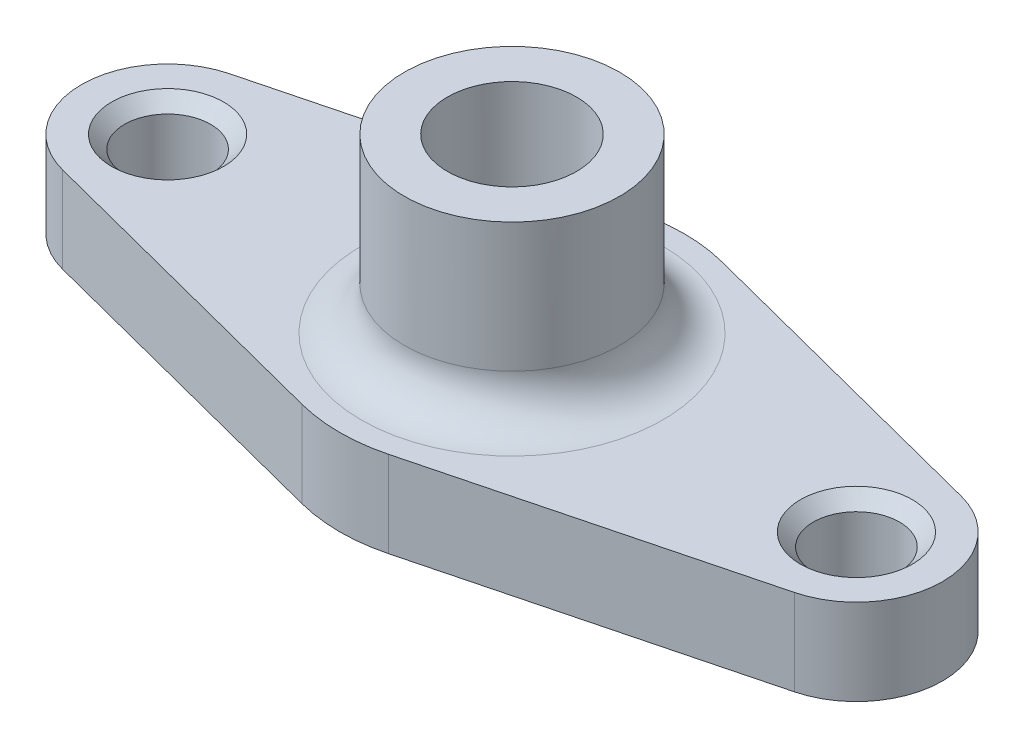
from build123d import *

# Parameters (mm, degrees)
SKETCH5_R            = 10
SKETCH5_R_2          = 40
SKETCH5_R_3          = 25
SKETCH5_R_4          = 15
BOSS_EXTRUDE11_DEPTH = 20
SKETCH11_R           = 25
SKETCH11_R_2         = 15
BOSS_EXTRUDE12_DEPTH = 60
CHAMFER3_SIZE        = 3
FILLET2_R            = 10
CHAMFER4_SIZE        = 3


with BuildPart() as part:
    # Sketch5 → Boss-Extrude11 (new body)
    # profile 1 of 4: a face of its own
    with BuildSketch(Plane(origin=(0, 0, 0), x_dir=(1, 0, 0), z_dir=(0, 1, 0))):
        with BuildLine():
            ThreePointArc((-10, -38.729833462), (-40, 0), (-10, 38.729833462))
            Line((-10, 38.729833462), (-85, 19.364916731))
            ThreePointArc((-85, 19.364916731), (-100, 0), (-85, -19.364916731))
            Line((-85, -19.364916731), (-10, -38.729833462))
        make_face()
        with Locations(Location((-80, 0, 0), (0, 0, 270))):
            Circle(SKETCH5_R, mode=Mode.SUBTRACT)
    # profile 2 of 4: a face of its own
    with BuildSketch(Plane(origin=(0, 0, 0), x_dir=(1, 0, 0), z_dir=(0, 1, 0))):
        with BuildLine():
            Line((85, 19.364916731), (10, 38.729833462))
            ThreePointArc((10, 38.729833462), (31.622776602, 24.494897428), (40, 0))
            ThreePointArc((40, 0), (31.622776602, -24.494897428), (10, -38.729833462))
            Line((10, -38.729833462), (85, -19.364916731))
            ThreePointArc((85, -19.364916731), (100, 0), (85, 19.364916731))
        make_face()
        with Locations(Location((80, 0, 0), (0, 0, 270))):
            Circle(SKETCH5_R, mode=Mode.SUBTRACT)
    # profile 3 of 4: a face of its own
    with BuildSketch(Plane(origin=(0, 0, 0), x_dir=(1, 0, 0), z_dir=(0, 1, 0))):
        Circle(SKETCH5_R_2)
        Circle(SKETCH5_R_3, mode=Mode.SUBTRACT)
    # profile 4 of 4: a face of its own
    with BuildSketch(Plane(origin=(0, 0, 0), x_dir=(1, 0, 0), z_dir=(0, 1, 0))):
        Circle(SKETCH5_R_3)
        with Locations(Location((0, 0, 0), (0, 0, 270))):
            Circle(SKETCH5_R_4, mode=Mode.SUBTRACT)
    extrude(amount=BOSS_EXTRUDE11_DEPTH)

    # Sketch11 → Boss-Extrude12 (add)
    with BuildSketch(Plane.XZ):
        with Locations(Location((0, 0, 0), (0, 0, 270))):
            Circle(SKETCH11_R)
        with Locations(Location((0, 0, 0), (0, 0, 270))):
            Circle(SKETCH11_R_2, mode=Mode.SUBTRACT)
    extrude(amount=-BOSS_EXTRUDE12_DEPTH)

    # Chamfer3
    chamfer3_edges = [part.edges().sort_by_distance(p)[0] for p in [
        (-80, 20, -10),
    ]]
    chamfer(chamfer3_edges, length=CHAMFER3_SIZE)

    # Fillet2
    fillet2_edges = [part.edges().sort_by_distance(p)[0] for p in [
        (0, 20, 25),
    ]]
    fillet(fillet2_edges, radius=FILLET2_R)

    # Chamfer4
    chamfer4_edges = [part.edges().sort_by_distance(p)[0] for p in [
        (80, 20, -10),
    ]]
    chamfer(chamfer4_edges, length=CHAMFER4_SIZE)


solid = part.part
